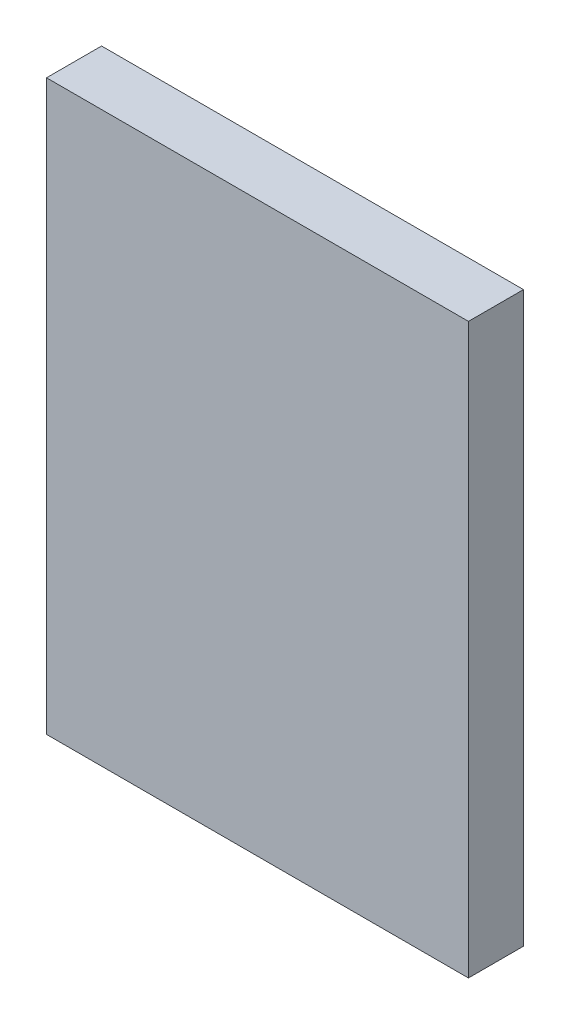
from build123d import *

# Parameters (mm, degrees)
SKICA1_W                = 11.5
SKICA1_H                = 15.5
P_IDAT_VYSUNUT_M2_DEPTH = 1.5


with BuildPart() as part:
    # Skica1 → Přidat vysunutím2 (new body)
    with BuildSketch(Plane.XY):
        Rectangle(SKICA1_W, SKICA1_H)
    extrude(amount=P_IDAT_VYSUNUT_M2_DEPTH)


solid = part.part
